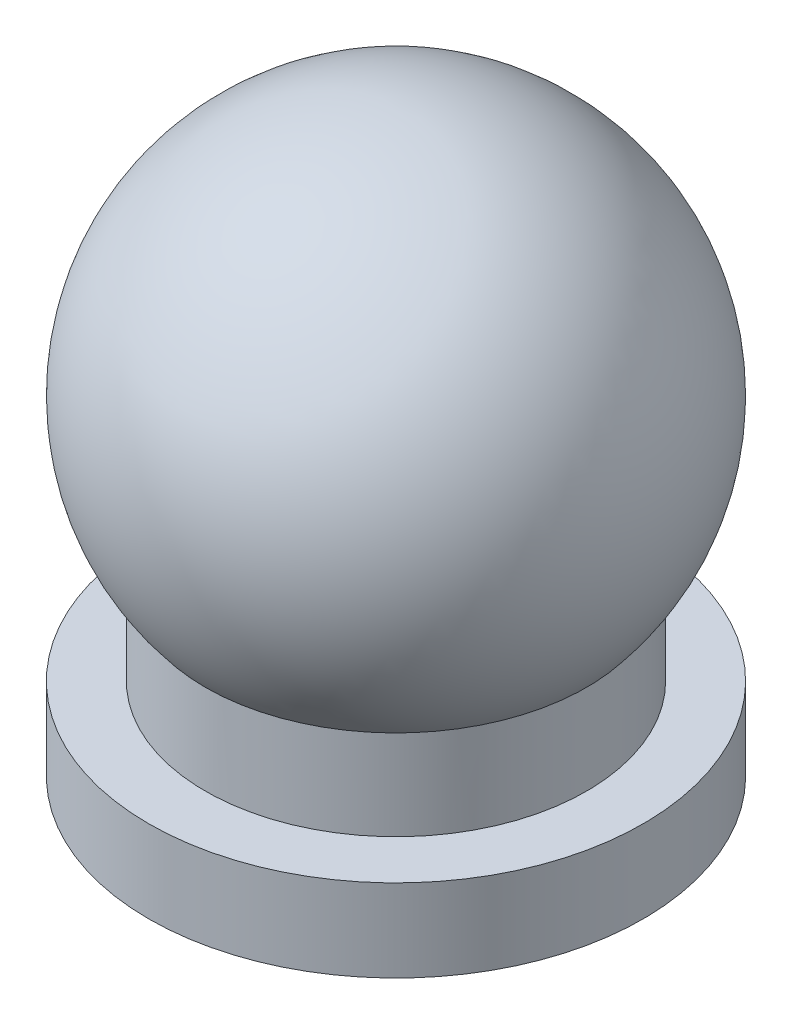
from build123d import *

# Parameters (mm, degrees)
SKETCH1_R           = 3
BOSS_EXTRUDE1_DEPTH = 1
SKETCH4_R           = 1.5
CUT_EXTRUDE1_DEPTH  = 5.5


with BuildPart() as part:
    # Sketch1 → Boss-Extrude1 (new body)
    with BuildSketch(Plane(origin=(0, 0, 0), x_dir=(1, 0, 0), z_dir=(0, 1, 0))):
        with Locations(Location((0, 0, 0), (0, 0, 270))):
            Circle(SKETCH1_R)
    extrude(amount=BOSS_EXTRUDE1_DEPTH)

    # Sketch3 → Revolve2 (revolve)
    with BuildSketch(Plane(origin=(0, 0, 0), x_dir=(0, 0, -1), z_dir=(1, 0, 0))):
        with BuildLine():
            Line((-1.156919819, 1), (0, 1))
            Line((0, 1), (0, 4))
            Line((0, 4), (0, 7))
            ThreePointArc((0, 7), (-2.121320344, 6.121320344), (-3, 4))
            ThreePointArc((-3, 4), (-2.823253346, 2.98548507), (-2.313839638, 2.090511553))
            Line((-2.313839638, 2.090511553), (-2.313839638, 1))
            Line((-2.313839638, 1), (-1.156919819, 1))
        make_face()
    revolve(axis=Axis((0, 4, 0), (0, 1, 0)))

    # Sketch4 → Cut-Extrude1 (cut)
    with BuildSketch(Plane.XZ):
        with Locations(Location((0, 0, 0), (0, 0, 270))):
            Circle(SKETCH4_R)
    extrude(amount=-CUT_EXTRUDE1_DEPTH, mode=Mode.SUBTRACT)


solid = part.part
